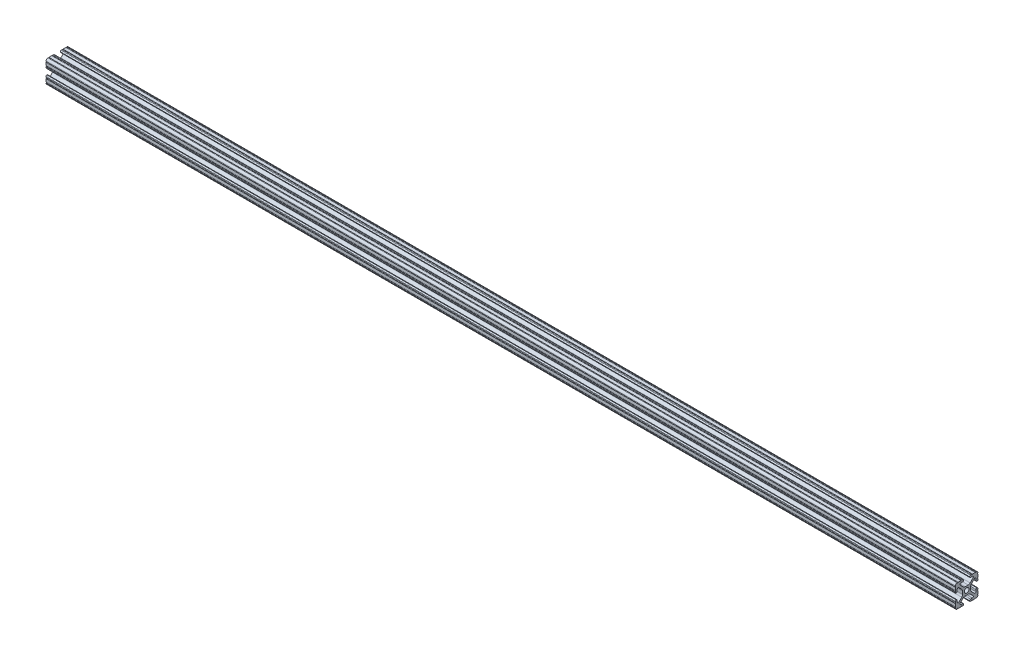
from build123d import *

# Parameters (mm, degrees)
SKETCH1_R           = 2.6035
BOSS_EXTRUDE1_DEPTH = 508


with BuildPart() as part:
    # Sketch1 → Boss-Extrude1 (new, symmetric)
    with BuildSketch(Plane(origin=(0, 0, 0), x_dir=(0, 0, -1), z_dir=(1, 0, 0))):
        with BuildLine():
            Line((6.333126718, -12.7), (9.550443118, -12.7))
            ThreePointArc((9.550443118, -12.7), (10.058366869, -12.192000006), (10.566443095, -12.699847501))
            ThreePointArc((10.566443095, -12.699847501), (12.082537762, -12.08250727), (12.699846982, -10.566399977))
            ThreePointArc((12.699846982, -10.566399977), (12.192000006, -10.058323491), (12.7, -9.5504))
            Line((12.7, -9.5504), (12.7, -6.3330836))
            ThreePointArc((12.7, -6.3330836), (12.192, -5.8250836), (12.7, -5.3170836))
            Line((12.7, -5.3170836), (12.7, -4.287469289))
            ThreePointArc((12.7, -4.287469289), (12.39275138, -3.545705502), (11.650987593, -3.238456882))
            Line((11.650987593, -3.238456882), (11.539212407, -3.238456882))
            ThreePointArc((11.539212407, -3.238456882), (10.79744862, -3.545705502), (10.4902, -4.287469289))
            Line((10.4902, -4.287469289), (10.4902, -6.402089023))
            ThreePointArc((10.4902, -6.402089023), (9.856505071, -7.351067942), (8.737131347, -7.129408934))
            Line((8.737131347, -7.129408934), (5.441005833, -3.840816462))
            ThreePointArc((5.441005833, -3.840816462), (4.750877967, -2.809883091), (4.5085, -1.593185507))
            Line((4.5085, -1.593185507), (4.5085, 1.593185507))
            ThreePointArc((4.5085, 1.593185507), (4.750877967, 2.809883091), (5.441005833, 3.840816462))
            Line((5.441005833, 3.840816462), (8.737131347, 7.129408934))
            ThreePointArc((8.737131347, 7.129408934), (9.856505071, 7.351067942), (10.4902, 6.402089023))
            Line((10.4902, 6.402089023), (10.4902, 4.287469289))
            ThreePointArc((10.4902, 4.287469289), (10.79744862, 3.545705502), (11.539212407, 3.238456882))
            Line((11.539212407, 3.238456882), (11.650987593, 3.238456882))
            ThreePointArc((11.650987593, 3.238456882), (12.39275138, 3.545705502), (12.7, 4.287469289))
            Line((12.7, 4.287469289), (12.7, 5.3170836))
            ThreePointArc((12.7, 5.3170836), (12.192, 5.8250836), (12.7, 6.3330836))
            Line((12.7, 6.3330836), (12.7, 9.5504))
            ThreePointArc((12.7, 9.5504), (12.192000006, 10.058323491), (12.699846982, 10.566399977))
            ThreePointArc((12.699846982, 10.566399977), (12.082537762, 12.08250727), (10.566443095, 12.699847501))
            ThreePointArc((10.566443095, 12.699847501), (10.058366869, 12.192000006), (9.550443118, 12.7))
            Line((9.550443118, 12.7), (6.333126718, 12.7))
            ThreePointArc((6.333126718, 12.7), (5.825126718, 12.192), (5.317126718, 12.7))
            Line((5.317126718, 12.7), (4.287512407, 12.7))
            ThreePointArc((4.287512407, 12.7), (3.54574862, 12.39275138), (3.2385, 11.650987593))
            Line((3.2385, 11.650987593), (3.2385, 11.539212407))
            ThreePointArc((3.2385, 11.539212407), (3.54574862, 10.79744862), (4.287512407, 10.4902))
            Line((4.287512407, 10.4902), (6.476788598, 10.4902))
            ThreePointArc((6.476788598, 10.4902), (7.432222385, 9.85140422), (7.207036008, 8.724370562))
            Line((7.207036008, 8.724370562), (3.898272566, 5.423169045))
            ThreePointArc((3.898272566, 5.423169045), (2.869120213, 4.736787962), (1.655778399, 4.4958))
            Line((1.655778399, 4.4958), (-1.655778399, 4.4958))
            ThreePointArc((-1.655778399, 4.4958), (-2.869120213, 4.736787962), (-3.898272566, 5.423169045))
            Line((-3.898272566, 5.423169045), (-7.207036008, 8.724370562))
            ThreePointArc((-7.207036008, 8.724370562), (-7.432222385, 9.85140422), (-6.476788598, 10.4902))
            Line((-6.476788598, 10.4902), (-4.287512407, 10.4902))
            ThreePointArc((-4.287512407, 10.4902), (-3.54574862, 10.79744862), (-3.2385, 11.539212407))
            Line((-3.2385, 11.539212407), (-3.2385, 11.650987593))
            ThreePointArc((-3.2385, 11.650987593), (-3.54574862, 12.39275138), (-4.287512407, 12.7))
            Line((-4.287512407, 12.7), (-5.317126718, 12.7))
            ThreePointArc((-5.317126718, 12.7), (-5.825126718, 12.192), (-6.333126718, 12.7))
            Line((-6.333126718, 12.7), (-9.550443118, 12.7))
            ThreePointArc((-9.550443118, 12.7), (-10.058366869, 12.192000006), (-10.566443095, 12.699847501))
            ThreePointArc((-10.566443095, 12.699847501), (-12.082537762, 12.08250727), (-12.699846982, 10.566399977))
            ThreePointArc((-12.699846982, 10.566399977), (-12.192000006, 10.058323491), (-12.7, 9.5504))
            Line((-12.7, 9.5504), (-12.7, 6.3330836))
            ThreePointArc((-12.7, 6.3330836), (-12.192, 5.8250836), (-12.7, 5.3170836))
            Line((-12.7, 5.3170836), (-12.7, 4.287469289))
            ThreePointArc((-12.7, 4.287469289), (-12.39275138, 3.545705502), (-11.650987593, 3.238456882))
            Line((-11.650987593, 3.238456882), (-11.539212407, 3.238456882))
            ThreePointArc((-11.539212407, 3.238456882), (-10.79744862, 3.545705502), (-10.4902, 4.287469289))
            Line((-10.4902, 4.287469289), (-10.4902, 6.402089023))
            ThreePointArc((-10.4902, 6.402089023), (-9.856505071, 7.351067942), (-8.737131347, 7.129408934))
            Line((-8.737131347, 7.129408934), (-5.441005833, 3.840816462))
            ThreePointArc((-5.441005833, 3.840816462), (-4.750877967, 2.809883091), (-4.5085, 1.593185507))
            Line((-4.5085, 1.593185507), (-4.5085, -1.593185507))
            ThreePointArc((-4.5085, -1.593185507), (-4.750877967, -2.809883091), (-5.441005833, -3.840816462))
            Line((-5.441005833, -3.840816462), (-8.737131347, -7.129408934))
            ThreePointArc((-8.737131347, -7.129408934), (-9.856505071, -7.351067942), (-10.4902, -6.402089023))
            Line((-10.4902, -6.402089023), (-10.4902, -4.287469289))
            ThreePointArc((-10.4902, -4.287469289), (-10.79744862, -3.545705502), (-11.539212407, -3.238456882))
            Line((-11.539212407, -3.238456882), (-11.650987593, -3.238456882))
            ThreePointArc((-11.650987593, -3.238456882), (-12.39275138, -3.545705502), (-12.7, -4.287469289))
            Line((-12.7, -4.287469289), (-12.7, -5.3170836))
            ThreePointArc((-12.7, -5.3170836), (-12.192, -5.8250836), (-12.7, -6.3330836))
            Line((-12.7, -6.3330836), (-12.7, -9.5504))
            ThreePointArc((-12.7, -9.5504), (-12.192000006, -10.058323491), (-12.699846982, -10.566399977))
            ThreePointArc((-12.699846982, -10.566399977), (-12.082537762, -12.08250727), (-10.566443095, -12.699847501))
            ThreePointArc((-10.566443095, -12.699847501), (-10.058366869, -12.192000006), (-9.550443118, -12.7))
            Line((-9.550443118, -12.7), (-6.333126718, -12.7))
            ThreePointArc((-6.333126718, -12.7), (-5.825126718, -12.192), (-5.317126718, -12.7))
            Line((-5.317126718, -12.7), (-4.287512407, -12.7))
            ThreePointArc((-4.287512407, -12.7), (-3.54574862, -12.39275138), (-3.2385, -11.650987593))
            Line((-3.2385, -11.650987593), (-3.2385, -11.539212407))
            ThreePointArc((-3.2385, -11.539212407), (-3.54574862, -10.79744862), (-4.287512407, -10.4902))
            Line((-4.287512407, -10.4902), (-6.416408329, -10.4902))
            ThreePointArc((-6.416408329, -10.4902), (-7.41473083, -9.822813117), (-7.179650497, -8.645192506))
            Line((-7.179650497, -8.645192506), (-3.952270251, -5.423690499))
            ThreePointArc((-3.952270251, -5.423690499), (-2.922936451, -4.736929036), (-1.709253557, -4.4958))
            Line((-1.709253557, -4.4958), (1.709253557, -4.4958))
            ThreePointArc((1.709253557, -4.4958), (2.922936451, -4.736929036), (3.952270251, -5.423690499))
            Line((3.952270251, -5.423690499), (7.179650497, -8.645192506))
            ThreePointArc((7.179650497, -8.645192506), (7.41473083, -9.822813117), (6.416408329, -10.4902))
            Line((6.416408329, -10.4902), (4.287512407, -10.4902))
            ThreePointArc((4.287512407, -10.4902), (3.54574862, -10.79744862), (3.2385, -11.539212407))
            Line((3.2385, -11.539212407), (3.2385, -11.650987593))
            ThreePointArc((3.2385, -11.650987593), (3.54574862, -12.39275138), (4.287512407, -12.7))
            Line((4.287512407, -12.7), (5.317126718, -12.7))
            ThreePointArc((5.317126718, -12.7), (5.825126718, -12.192), (6.333126718, -12.7))
        make_face()
        Circle(SKETCH1_R, mode=Mode.SUBTRACT)
    extrude(amount=BOSS_EXTRUDE1_DEPTH, both=True)


solid = part.part
